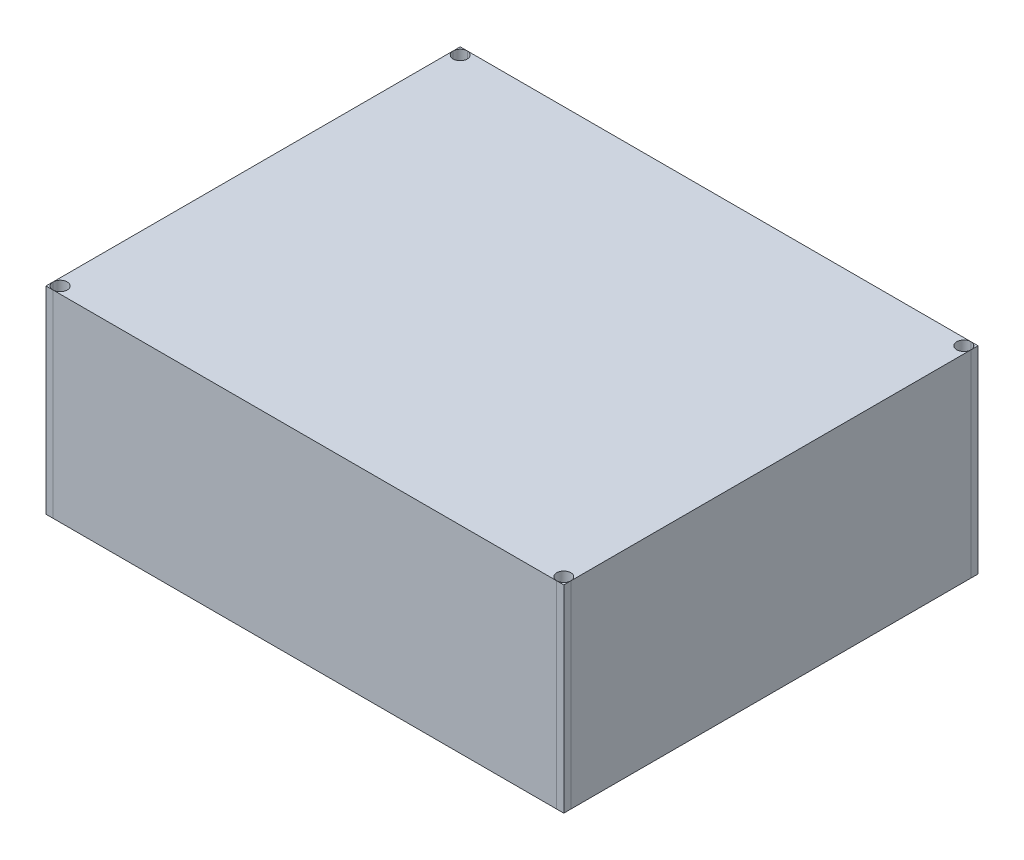
from build123d import *

# Parameters (mm, degrees)
SKETCH_1_W          = 110
SKETCH_1_H          = 88
EXTRUDE_1_DEPTH     = 42
SKETCH_3_R          = 1.5
CUT_EXTRUDE_1_DEPTH = 83.006097334


with BuildPart() as part:
    # 草圖1 → 填料-伸長1 (new body)
    with BuildSketch(Plane(origin=(0, 0, 0), x_dir=(1, 0, 0), z_dir=(0, 1, 0))):
        Rectangle(SKETCH_1_W, SKETCH_1_H)
    extrude(amount=EXTRUDE_1_DEPTH)

    # 草圖3 → 除料-伸長1 (cut, through all)
    with BuildSketch(Plane(origin=(0, 42, 0), x_dir=(1, 0, 0), z_dir=(0, 1, 0))):
        with Locations((53.5, -42.5)):
            Circle(SKETCH_3_R)
        with Locations((53.5, 42.5)):
            Circle(SKETCH_3_R)
        with Locations((-53.5, 42.5)):
            Circle(SKETCH_3_R)
        with Locations((-53.5, -42.5)):
            Circle(SKETCH_3_R)
    extrude(amount=-CUT_EXTRUDE_1_DEPTH, mode=Mode.SUBTRACT)


solid = part.part
